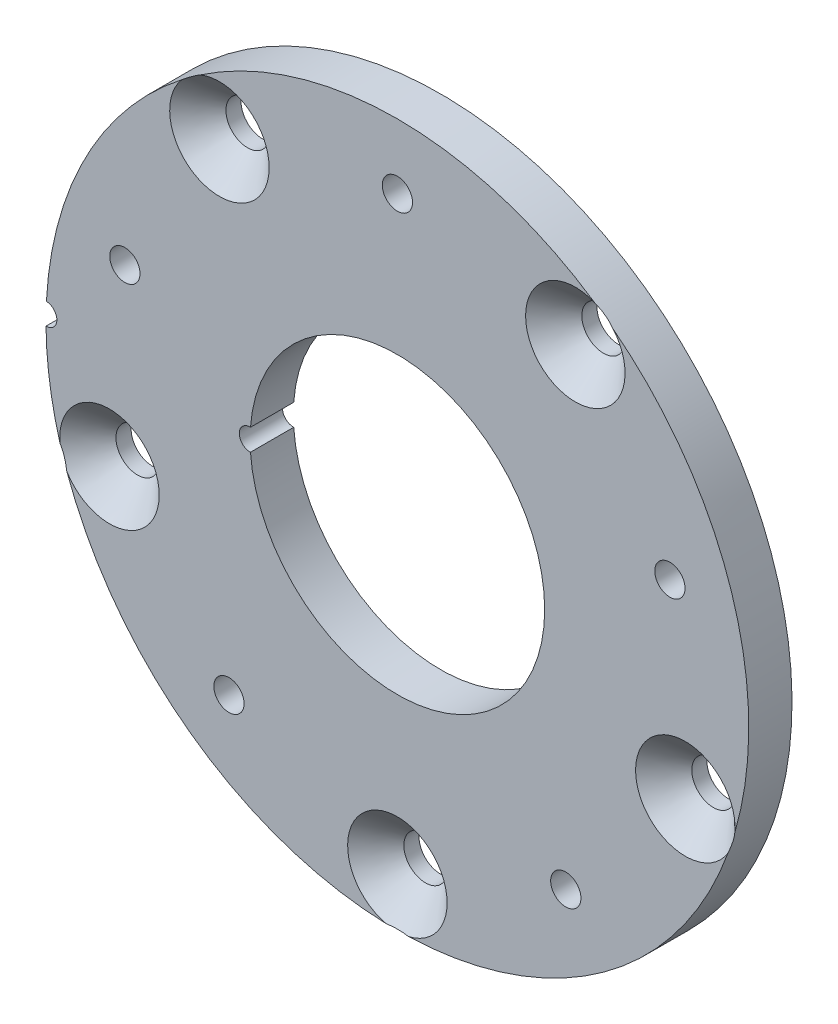
from build123d import *

# Parameters (mm, degrees)
SKETCH_1_R               = 32.5
SKETCH_1_R_2             = 13.625
SKETCH_1_R_3             = 2
SKETCH_1_R_4             = 1.4
EXTRUDE_1_DEPTH          = 4
SKETCH_2_R               = 1
CUT_EXTRUDE_1_DEPTH      = 10
PATTERN_CIRCULAR_1_COUNT = 5


with BuildPart() as part:
    # 草图1 → 凸台-拉伸1 (new body)
    with BuildSketch(Plane.XY):
        Circle(SKETCH_1_R)
        Circle(SKETCH_1_R_2, mode=Mode.SUBTRACT)
        with Locations((0, -28)):
            Circle(SKETCH_1_R_3, mode=Mode.SUBTRACT)
        with Locations((-26.629582456, -8.652475842)):
            Circle(SKETCH_1_R_3, mode=Mode.SUBTRACT)
        with Locations((-16.457987064, 22.652475842)):
            Circle(SKETCH_1_R_3, mode=Mode.SUBTRACT)
        with Locations((16.457987064, 22.652475842)):
            Circle(SKETCH_1_R_3, mode=Mode.SUBTRACT)
        with Locations((26.629582456, -8.652475842)):
            Circle(SKETCH_1_R_3, mode=Mode.SUBTRACT)
        with Locations((-15.576309186, -21.438950351)):
            Circle(SKETCH_1_R_4, mode=Mode.SUBTRACT)
        with Locations((-25.202997682, 8.188950351)):
            Circle(SKETCH_1_R_4, mode=Mode.SUBTRACT)
        with Locations((0, 26.5)):
            Circle(SKETCH_1_R_4, mode=Mode.SUBTRACT)
        with Locations((25.202997682, 8.188950351)):
            Circle(SKETCH_1_R_4, mode=Mode.SUBTRACT)
        with Locations((15.576309186, -21.438950351)):
            Circle(SKETCH_1_R_4, mode=Mode.SUBTRACT)
    extrude(amount=EXTRUDE_1_DEPTH)

    # 草图2 → 切除-拉伸1 (cut)
    with BuildSketch(Plane.XY.offset(4)):
        with Locations((-13.625, 0)):
            Circle(SKETCH_2_R)
        with Locations((-32.49354651, 0.647638152)):
            Circle(SKETCH_2_R)
    extrude(amount=-CUT_EXTRUDE_1_DEPTH, mode=Mode.SUBTRACT)

    # 草图5 → 切除-旋转2 (revolve, cut)
    with BuildSketch(Plane(origin=(0, 0, 0), x_dir=(0, 0, -1), z_dir=(1, 0, 0)), mode=Mode.PRIVATE) as cut_revolve_2_sk:
        Polygon((-4, -28), (-1.4, -28), (-1.4, -30), (-4, -32.6), align=None)
    cut_revolve_2 = revolve(cut_revolve_2_sk.sketch.rotate(Axis((0, -28, 4), (0, 0, -1)), 270), axis=Axis((0, -28, 4), (0, 0, -1)), mode=Mode.SUBTRACT)

    # 阵列(圆周)1: 切除-旋转2 ×5 about axis
    pattern_circular_1_axis = Axis((0, 0, 0), (0, 0, 1))
    for i in range(1, PATTERN_CIRCULAR_1_COUNT):
        add(cut_revolve_2.rotate(pattern_circular_1_axis, i * 360 / PATTERN_CIRCULAR_1_COUNT), mode=Mode.SUBTRACT)


solid = part.part
